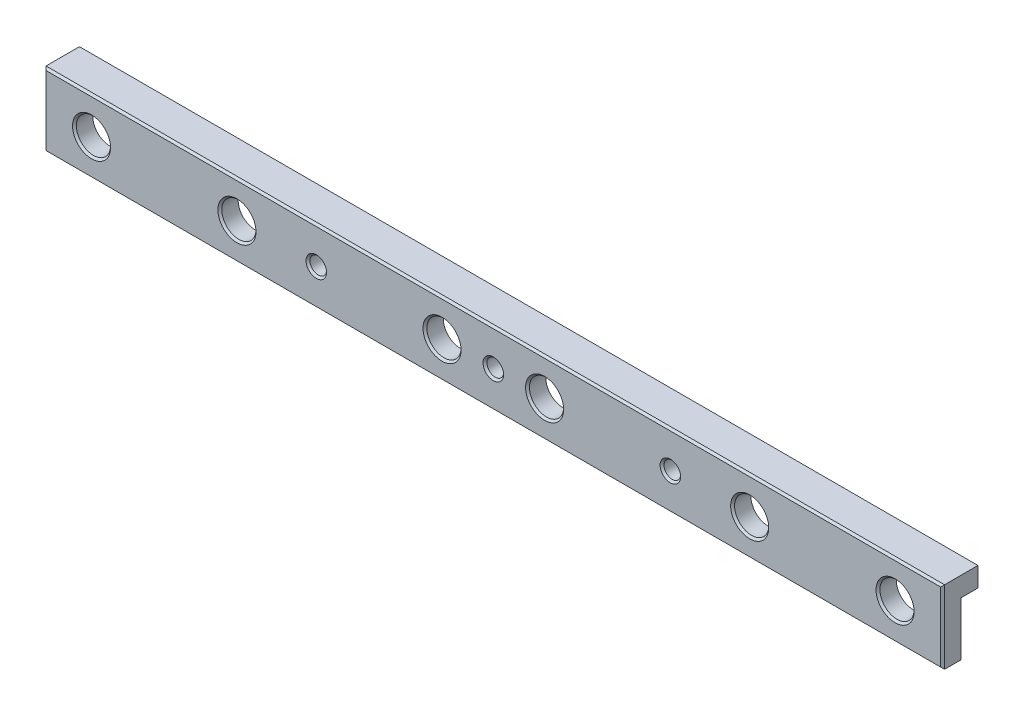
from build123d import *

# Parameters (mm, degrees)
SKETCH1_W               = 184
SKETCH1_H               = 15
BOSS_EXTRUDE1_DEPTH     = 7.25
CUT_EXTRUDE1_START      = -7.25
SKETCH1_6_W             = 184
SKETCH1_6_H             = 11
CUT_EXTRUDE1_DEPTH      = 3.5
CUT_EXTRUDE2_DEPTH      = 93.589483744
CUT_EXTRUDE2_DEPTH_BACK = 93.589483744
SKETCH2_R               = 3.5
SKETCH2_R_2             = 1.7
CHAMFER1_SIZE           = 0.4


with BuildPart() as part:
    # Sketch1 → Boss-Extrude1 (new body)
    with BuildSketch(Plane.XY):
        Rectangle(SKETCH1_W, SKETCH1_H)
    extrude(amount=-BOSS_EXTRUDE1_DEPTH)

    # Sketch1<6> → Cut-Extrude1 (cut)
    with BuildSketch(Plane.XY.offset(CUT_EXTRUDE1_START)):
        with Locations((0, -2)):
            Rectangle(SKETCH1_6_W, SKETCH1_6_H)
    extrude(amount=CUT_EXTRUDE1_DEPTH, mode=Mode.SUBTRACT)

    # Sketch2 → Cut-Extrude2 (cut, two sides: drawn at the far end of the back side and taken through both)
    with BuildSketch(Plane.XY.offset(-CUT_EXTRUDE2_DEPTH_BACK)):
        with Locations((-52.5, 0)):
            Circle(SKETCH2_R)
        with Locations((-36.25, 0)):
            Circle(SKETCH2_R_2)
        with Locations((-10.5, 0)):
            Circle(SKETCH2_R)
        Circle(SKETCH2_R_2)
        with Locations((10.5, 0)):
            Circle(SKETCH2_R)
        with Locations((36.25, 0)):
            Circle(SKETCH2_R_2)
        with Locations((52.5, 0)):
            Circle(SKETCH2_R)
        with Locations((-82.27, 0)):
            Circle(SKETCH2_R)
        with Locations((82.27, 0)):
            Circle(SKETCH2_R)
    extrude(amount=CUT_EXTRUDE2_DEPTH + CUT_EXTRUDE2_DEPTH_BACK, mode=Mode.SUBTRACT)

    # Chamfer1
    chamfer1_edges = [part.edges().sort_by_distance(p)[0] for p in [
        (-37.95, 0, 0),
        (-14, 0, 0),
        (-1.7, 0, 0),
        (7, 0, 0),
        (0, -7.5, 0),
        (78.77, 0, 0),
        (-92, 0, 0),
        (-85.77, 0, 0),
        (49, 0, 0),
        (34.55, 0, 0),
        (0, 7.5, 0),
        (-56, 0, 0),
        (92, 0, 0),
    ]]
    chamfer(chamfer1_edges, length=CHAMFER1_SIZE)


solid = part.part
